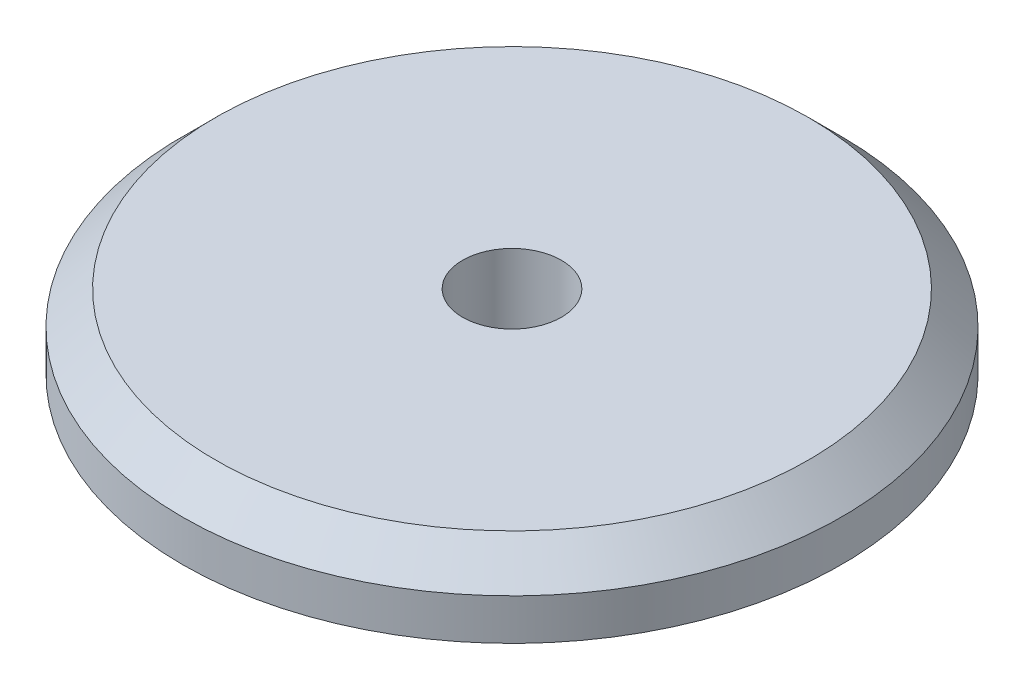
from build123d import *

# Parameters (mm, degrees)
SKETCH3_R           = 100
BOSS_EXTRUDE1_DEPTH = 22.5
CHAMFER1_SIZE       = 10
CUT_EXTRUDE1_DEPTH  = 25.25
CIRPATTERN1_COUNT   = 6
SKETCH5_R           = 15
CUT_EXTRUDE2_DEPTH  = 22.5


with BuildPart() as part:
    # Sketch3 → Boss-Extrude1 (new body)
    with BuildSketch(Plane(origin=(0, 0, 0), x_dir=(1, 0, 0), z_dir=(0, 1, 0))):
        with Locations(Location((0, 0, 0), (0, 0, 90))):
            Circle(SKETCH3_R)
    extrude(amount=BOSS_EXTRUDE1_DEPTH)

    # Chamfer1
    chamfer1_edges = [part.edges().sort_by_distance(p)[0] for p in [
        (0, 22.5, 100),
    ]]
    chamfer(chamfer1_edges, length=CHAMFER1_SIZE)

    # Sketch4 → Cut-Extrude1 (cut, symmetric)
    with BuildSketch(Plane.XY):
        Polygon((-75.630877335, 0), (-72.480463966, 9.69597536), (-71.909830056, 9.510565163), (-75, 0), align=None)
    cut_extrude1 = extrude(amount=CUT_EXTRUDE1_DEPTH, both=True, mode=Mode.SUBTRACT)

    # CirPattern1: Cut-Extrude1 ×6 about axis
    cirpattern1_axis = Axis((0, 0, 0), (0, 1, 0))
    for i in range(1, CIRPATTERN1_COUNT):
        add(cut_extrude1.rotate(cirpattern1_axis, i * 360 / CIRPATTERN1_COUNT), mode=Mode.SUBTRACT)

    # Sketch5 → Cut-Extrude2 (cut)
    with BuildSketch(Plane(origin=(0, 22.5, 0), x_dir=(1, 0, 0), z_dir=(0, 1, 0))):
        with Locations(Location((0, 0, 0), (0, 0, 270))):
            Circle(SKETCH5_R)
    extrude(amount=-CUT_EXTRUDE2_DEPTH, mode=Mode.SUBTRACT)


solid = part.part
